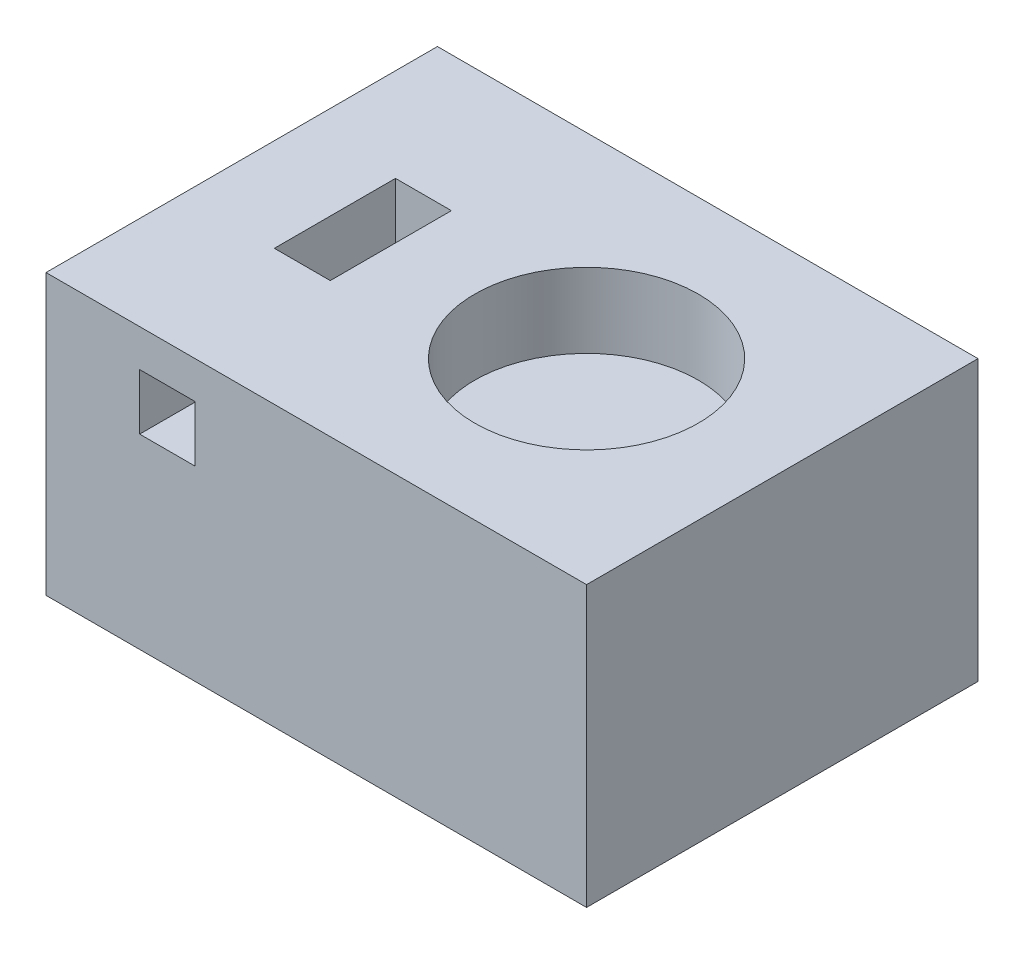
from build123d import *

# Parameters (mm, degrees)
ESQUISSE1_W             = 42
ESQUISSE1_H             = 42
BOSS_EXTRU_1_DEPTH      = 30
ESQUISSE2_R             = 12
ENL_V_MAT_EXTRU_1_DEPTH = 8
ESQUISSE4_W             = 42
ESQUISSE4_H             = 30
BOSS_EXTRU_3_DEPTH      = 16
ESQUISSE5_W             = 6
ESQUISSE5_H             = 13
ENL_V_MAT_EXTRU_2_DEPTH = 11
ESQUISSE6_W             = 5.949379811
ESQUISSE6_H             = 6
ENL_V_MAT_EXTRU_3_DEPTH = 56.00227268


with BuildPart() as part:
    # Esquisse1 → Boss.-Extru.1 (new body)
    with BuildSketch(Plane(origin=(0, 0, 0), x_dir=(1, 0, 0), z_dir=(0, 1, 0))):
        Rectangle(ESQUISSE1_W, ESQUISSE1_H)
    extrude(amount=BOSS_EXTRU_1_DEPTH)

    # Esquisse2 → Enlèv. mat.-Extru.1 (cut)
    with BuildSketch(Plane(origin=(0, 30, 0), x_dir=(1, 0, 0), z_dir=(0, 1, 0))):
        with Locations(Location((0, 0, 0), (0, 0, 270))):
            Circle(ESQUISSE2_R)
    extrude(amount=-ENL_V_MAT_EXTRU_1_DEPTH, mode=Mode.SUBTRACT)

    # Esquisse4 → Boss.-Extru.3 (add)
    with BuildSketch(Plane.ZY.offset(21)):
        with Locations((0, 15)):
            Rectangle(ESQUISSE4_W, ESQUISSE4_H)
    extrude(amount=BOSS_EXTRU_3_DEPTH)

    # Esquisse5 → Enlèv. mat.-Extru.2 (cut)
    with BuildSketch(Plane(origin=(0, 30, 0), x_dir=(1, 0, 0), z_dir=(0, 1, 0))):
        with Locations((-24, 0)):
            Rectangle(ESQUISSE5_W, ESQUISSE5_H)
    extrude(amount=-ENL_V_MAT_EXTRU_2_DEPTH, mode=Mode.SUBTRACT)

    # Esquisse6 → Enlèv. mat.-Extru.3 (cut, through all)
    with BuildSketch(Plane.XY.offset(-6.5)):
        with Locations((-23.974689906, 23.009155876)):
            Rectangle(ESQUISSE6_W, ESQUISSE6_H)
    extrude(amount=ENL_V_MAT_EXTRU_3_DEPTH, mode=Mode.SUBTRACT)


solid = part.part
